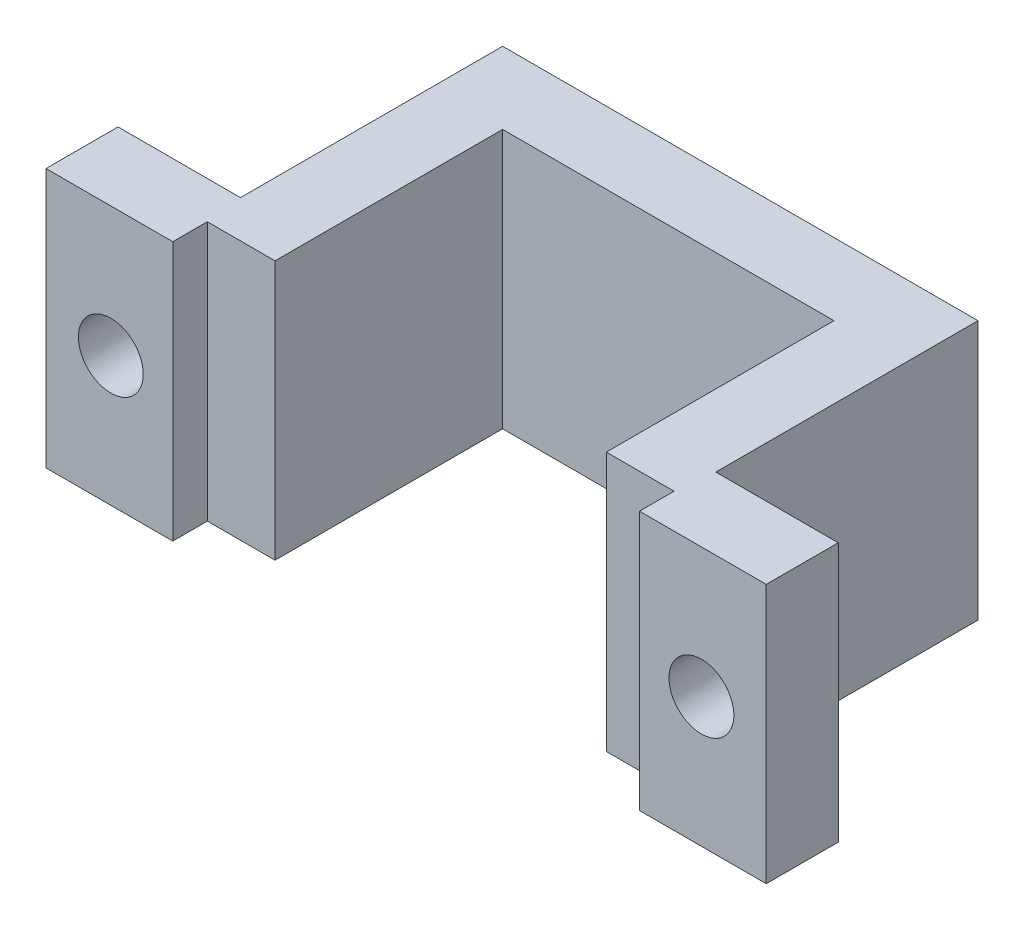
from build123d import *

# Parameters (mm, degrees)
BOSS_EXTRUDE1_DEPTH = 18
SKETCH2_R           = 2.25
CUT_EXTRUDE1_DEPTH  = 57.171523034


with BuildPart() as part:
    # Sketch1 → Boss-Extrude1 (new body)
    with BuildSketch(Plane(origin=(0, 0, 0), x_dir=(1, 0, 0), z_dir=(0, 1, 0))):
        Polygon((0, 0), (8.8, 0), (8.8, 2.4), (13.5, 2.4), (13.5, 18.2), (36.5, 18.2), (36.5, 2.4), (41.2, 2.4), (41.2, 0), (50, 0), (50, 5), (41.5, 5), (41.5, 23.2), (8.5, 23.2), (8.5, 5), (0, 5), align=None)
    extrude(amount=BOSS_EXTRUDE1_DEPTH)

    # Sketch2 → Cut-Extrude1 (cut, through all)
    with BuildSketch(Plane(origin=(0, 0, -5), x_dir=(-1, 0, 0), z_dir=(0, 0, -1))):
        with Locations((-45.5, 9)):
            Circle(SKETCH2_R)
        with Locations(Location((-4.5, 9, 0), (0, 0, 180))):
            Circle(SKETCH2_R)
    extrude(amount=-CUT_EXTRUDE1_DEPTH, mode=Mode.SUBTRACT)


solid = part.part
